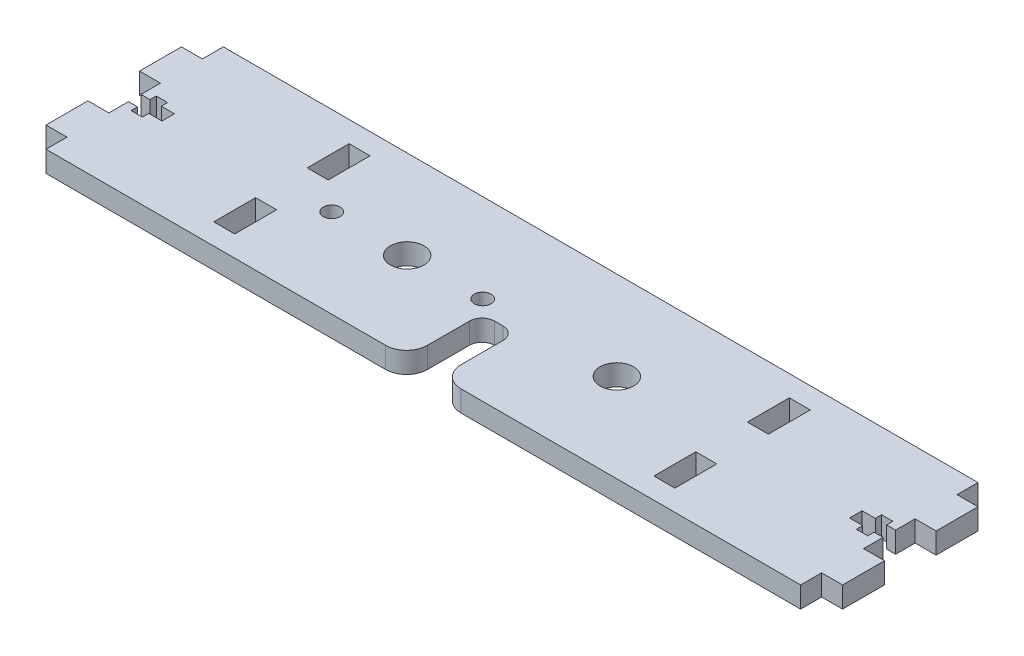
from build123d import *

# Parameters (mm, degrees)
SKETCH_1_R      = 4
SKETCH_1_R_2    = 2
SKETCH_1_W      = 5
SKETCH_1_H      = 10
EXTRUDE_1_DEPTH = 5


with BuildPart() as part:
    # 草图1 → 凸台-拉伸1 (new body)
    with BuildSketch(Plane(origin=(0, 0, 0), x_dir=(1, 0, 0), z_dir=(0, 1, 0))):
        with BuildLine():
            Line((-87.471894738, -35.047998618), (-6.471894738, -35.047998618))
            ThreePointArc((-6.471894738, -35.047998618), (-2.936360832, -33.583532524), (-1.471894738, -30.047998618))
            Line((-1.471894738, -30.047998618), (-1.471894738, -20.047998618))
            ThreePointArc((-1.471894738, -20.047998618), (-0.593215082, -17.926678275), (1.528105262, -17.047998618))
            Line((1.528105262, -17.047998618), (3.528105262, -17.047998618))
            ThreePointArc((3.528105262, -17.047998618), (5.649425606, -17.926678275), (6.528105262, -20.047998618))
            Line((6.528105262, -20.047998618), (6.528105262, -30.047998618))
            ThreePointArc((6.528105262, -30.047998618), (7.992571356, -33.583532524), (11.528105262, -35.047998618))
            Line((11.528105262, -35.047998618), (92.528105262, -35.047998618))
            Line((92.528105262, -35.047998618), (92.528105262, -30.047998618))
            Line((92.528105262, -30.047998618), (97.528105262, -30.047998618))
            Line((97.528105262, -30.047998618), (97.528105262, -20.047998618))
            Line((97.528105262, -20.047998618), (92.528105262, -20.047998618))
            Line((92.528105262, -20.047998618), (92.528105262, -15.388953653))
            Line((92.528105262, -15.388953653), (90.378105262, -15.388953653))
            Line((90.378105262, -15.388953653), (90.378105262, -16.897998618))
            Line((90.378105262, -16.897998618), (87.678105262, -16.897998618))
            Line((87.678105262, -16.897998618), (87.678105262, -15.388953653))
            Line((87.678105262, -15.388953653), (84.528105262, -15.388953653))
            Line((84.528105262, -15.388953653), (84.528105262, -12.397998618))
            Line((84.528105262, -12.397998618), (87.678105262, -12.397998618))
            Line((87.678105262, -12.397998618), (87.678105262, -10.897998618))
            Line((87.678105262, -10.897998618), (90.378105262, -10.897998618))
            Line((90.378105262, -10.897998618), (90.378105262, -12.397998618))
            Line((90.378105262, -12.397998618), (92.528105262, -12.397998618))
            Line((92.528105262, -12.397998618), (92.528105262, -7.747998618))
            Line((92.528105262, -7.747998618), (97.528105262, -7.747998618))
            Line((97.528105262, -7.747998618), (97.528105262, 2.252001382))
            Line((97.528105262, 2.252001382), (92.528105262, 2.252001382))
            Line((92.528105262, 2.252001382), (92.528105262, 7.252001382))
            Line((92.528105262, 7.252001382), (-87.471894738, 7.252001382))
            Line((-87.471894738, 7.252001382), (-87.471894738, 2.252001382))
            Line((-87.471894738, 2.252001382), (-92.471894738, 2.252001382))
            Line((-92.471894738, 2.252001382), (-92.471894738, -7.747998618))
            Line((-92.471894738, -7.747998618), (-87.471894738, -7.747998618))
            Line((-87.471894738, -7.747998618), (-87.471894738, -12.397998618))
            Line((-87.471894738, -12.397998618), (-85.321894738, -12.397998618))
            Line((-85.321894738, -12.397998618), (-85.321894738, -10.897998618))
            Line((-85.321894738, -10.897998618), (-82.621894738, -10.897998618))
            Line((-82.621894738, -10.897998618), (-82.621894738, -12.397998618))
            Line((-82.621894738, -12.397998618), (-79.471894738, -12.397998618))
            Line((-79.471894738, -12.397998618), (-79.471894738, -15.388953653))
            Line((-79.471894738, -15.388953653), (-82.621894738, -15.388953653))
            Line((-82.621894738, -15.388953653), (-82.621894738, -16.897998618))
            Line((-82.621894738, -16.897998618), (-85.321894738, -16.897998618))
            Line((-85.321894738, -16.897998618), (-85.321894738, -15.388953653))
            Line((-85.321894738, -15.388953653), (-87.471894738, -15.388953653))
            Line((-87.471894738, -15.388953653), (-87.471894738, -20.047998618))
            Line((-87.471894738, -20.047998618), (-92.471894738, -20.047998618))
            Line((-92.471894738, -20.047998618), (-92.471894738, -30.047998618))
            Line((-92.471894738, -30.047998618), (-87.471894738, -30.047998618))
            Line((-87.471894738, -30.047998618), (-87.471894738, -35.047998618))
        make_face()
        with Locations(Location((-22.471894738, -13.897998618, 0), (0, 0, 270))):
            Circle(SKETCH_1_R, mode=Mode.SUBTRACT)
        with Locations(Location((27.528105262, -13.897998618, 0), (0, 0, 270))):
            Circle(SKETCH_1_R, mode=Mode.SUBTRACT)
        with Locations(Location((-40.471894738, -13.897998618, 0), (0, 0, 270))):
            Circle(SKETCH_1_R_2, mode=Mode.SUBTRACT)
        with Locations(Location((-4.471894738, -13.897998618, 0), (0, 0, 270))):
            Circle(SKETCH_1_R_2, mode=Mode.SUBTRACT)
        with Locations((-49.971894738, -2.747998618)):
            Rectangle(SKETCH_1_W, SKETCH_1_H, mode=Mode.SUBTRACT)
        with Locations((-49.971894738, -25.047998618)):
            Rectangle(SKETCH_1_W, SKETCH_1_H, mode=Mode.SUBTRACT)
        with Locations((55.028105262, -25.047998618)):
            Rectangle(SKETCH_1_W, SKETCH_1_H, mode=Mode.SUBTRACT)
        with Locations((55.028105262, -2.747998618)):
            Rectangle(SKETCH_1_W, SKETCH_1_H, mode=Mode.SUBTRACT)
    extrude(amount=EXTRUDE_1_DEPTH)


solid = part.part
